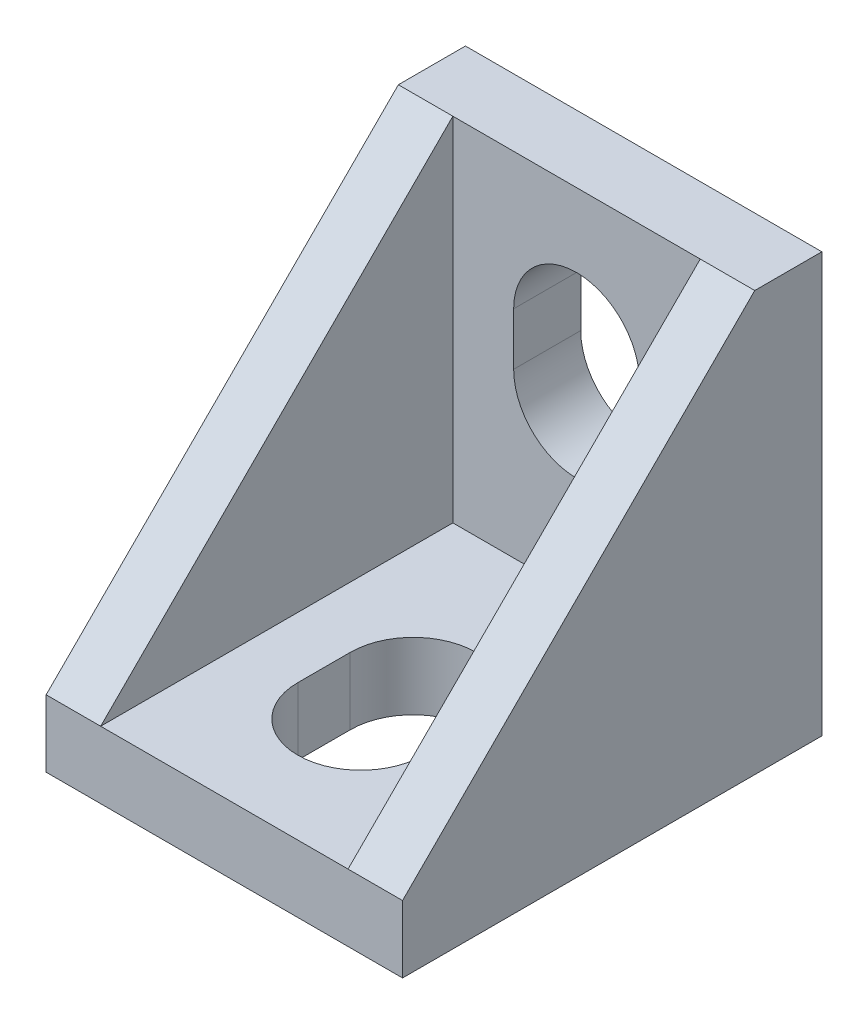
from build123d import *

# Parameters (mm, degrees)
SKETCH_1_W          = 17
SKETCH_1_H          = 20
EXTRUDE_1_DEPTH     = 3.2
SKETCH_2_W          = 17
SKETCH_2_H          = 3.2
EXTRUDE_2_DEPTH     = 16.8
EXTRUDE_3_DEPTH     = 2.6
CUT_EXTRUDE_1_DEPTH = 22.318771072


with BuildPart() as part:
    # 草图1 → 凸台-拉伸1 (new body)
    with BuildSketch(Plane.XY):
        Rectangle(SKETCH_1_W, SKETCH_1_H)
    extrude(amount=EXTRUDE_1_DEPTH)

    # 草图2 → 凸台-拉伸2 (add)
    with BuildSketch(Plane.XY.offset(3.2)):
        with Locations((0, -8.4)):
            Rectangle(SKETCH_2_W, SKETCH_2_H)
    extrude(amount=EXTRUDE_2_DEPTH)

    # 草图3 → 凸台-拉伸3 (add)
    with BuildSketch(Plane.ZY.offset(8.5)):
        Polygon((3.2, 10), (20, -6.8), (3.2, -6.8), align=None)
    extrude_3 = extrude(amount=-EXTRUDE_3_DEPTH)

    # 镜向1: 凸台-拉伸3 across plane
    add(extrude_3.mirror(Plane(origin=(0, 0, 0), x_dir=(0, 0, 1), z_dir=(1, 0, 0))))

    # 草图4 → 切除-拉伸1 (cut, through all)
    with BuildSketch(Plane.XY.offset(3.2)):
        with BuildLine():
            Line((3, 3.495071076), (3, 0.995071076))
            ThreePointArc((3, 0.995071076), (0, -2.004928924), (-3, 0.995071076))
            Line((-3, 0.995071076), (-3, 3.495071076))
            ThreePointArc((-3, 3.495071076), (0, 6.495071076), (3, 3.495071076))
        make_face()
    cut_extrude_1 = extrude(amount=-CUT_EXTRUDE_1_DEPTH, mode=Mode.SUBTRACT)

    # 镜向2: 切除-拉伸1 across plane
    add(cut_extrude_1.mirror(Plane(origin=(0, -5, 5), x_dir=(0, 0.7071067811865479, 0.7071067811865472), z_dir=(0, -0.7071067811865474, 0.7071067811865478))), mode=Mode.SUBTRACT)


solid = part.part
